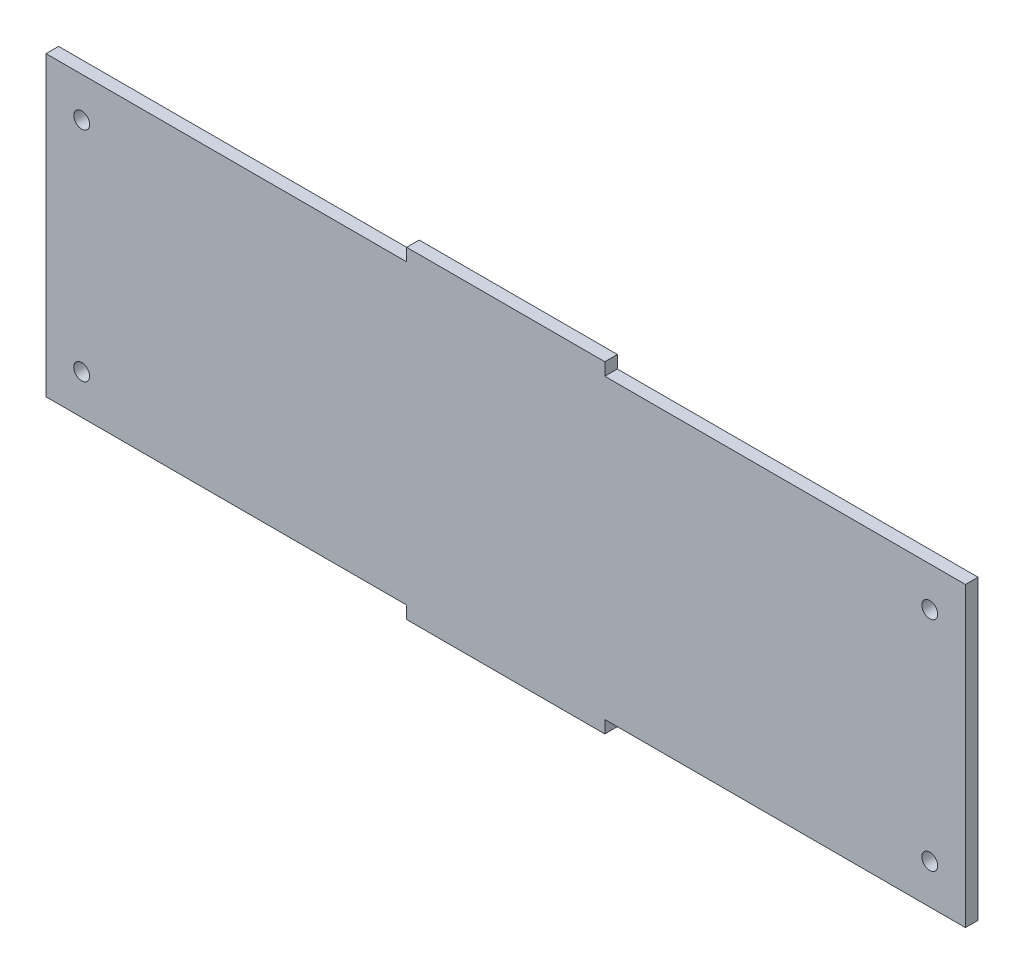
from build123d import *

# Parameters (mm, degrees)
SKETCH1_W           = 232
SKETCH1_H           = 75
SKETCH1_R           = 2
BOSS_EXTRUDE1_DEPTH = 3.175
SKETCH2_W           = 50
SKETCH2_H           = 3.175
BOSS_EXTRUDE2_DEPTH = 3.175


with BuildPart() as part:
    # Sketch1 → Boss-Extrude1 (new body)
    with BuildSketch(Plane.XY):
        with Locations((116, 37.5)):
            Rectangle(SKETCH1_W, SKETCH1_H)
        with Locations((9, 65)):
            Circle(SKETCH1_R, mode=Mode.SUBTRACT)
        with Locations(Location((9, 10, 0), (0, 0, 180))):
            Circle(SKETCH1_R, mode=Mode.SUBTRACT)
        with Locations((223, 10)):
            Circle(SKETCH1_R, mode=Mode.SUBTRACT)
        with Locations(Location((223, 65, 0), (0, 0, 180))):
            Circle(SKETCH1_R, mode=Mode.SUBTRACT)
    extrude(amount=BOSS_EXTRUDE1_DEPTH)

    # Sketch2 → Boss-Extrude2 (add)
    with BuildSketch(Plane.XY.offset(3.175)):
        with Locations((116, -1.5875)):
            Rectangle(SKETCH2_W, SKETCH2_H)
        with Locations((116, 76.5875)):
            Rectangle(SKETCH2_W, SKETCH2_H)
    extrude(amount=-BOSS_EXTRUDE2_DEPTH)


solid = part.part
